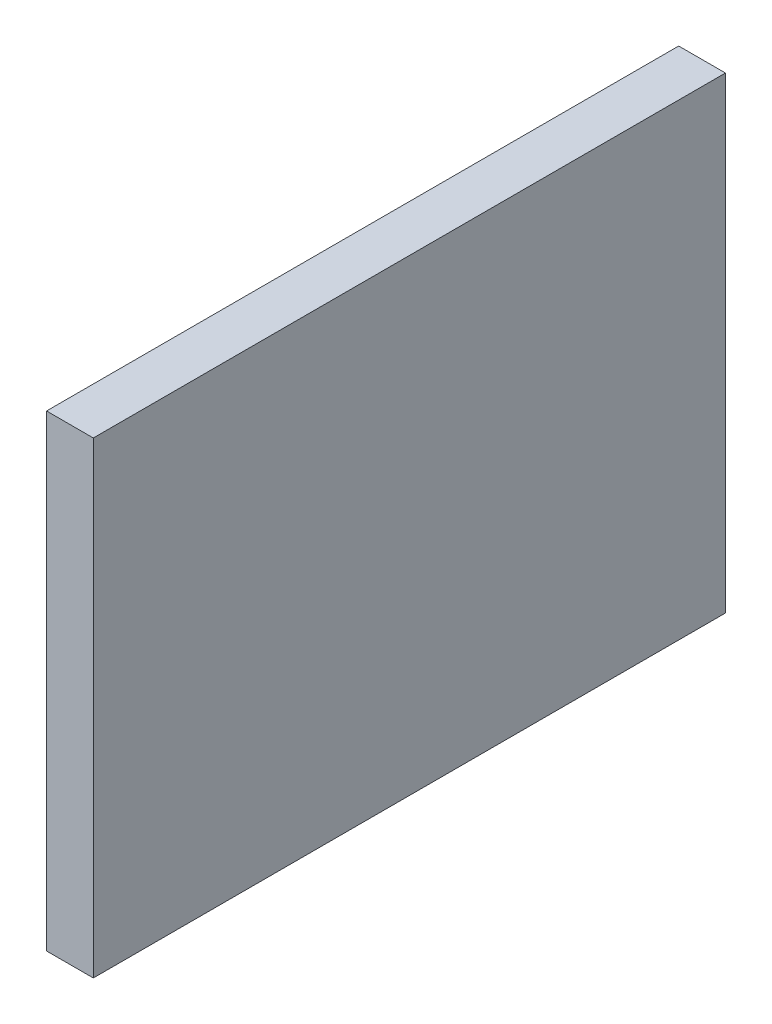
from build123d import *

# Parameters (mm, degrees)
SKETCH1_W           = 40.55
SKETCH1_H           = 30
BOSS_EXTRUDE1_DEPTH = 3


with BuildPart() as part:
    # Sketch1 → Boss-Extrude1 (new body)
    with BuildSketch(Plane(origin=(0, 0, 0), x_dir=(0, 0, -1), z_dir=(1, 0, 0))):
        with Locations((20.275, 15)):
            Rectangle(SKETCH1_W, SKETCH1_H)
    extrude(amount=BOSS_EXTRUDE1_DEPTH)


solid = part.part
